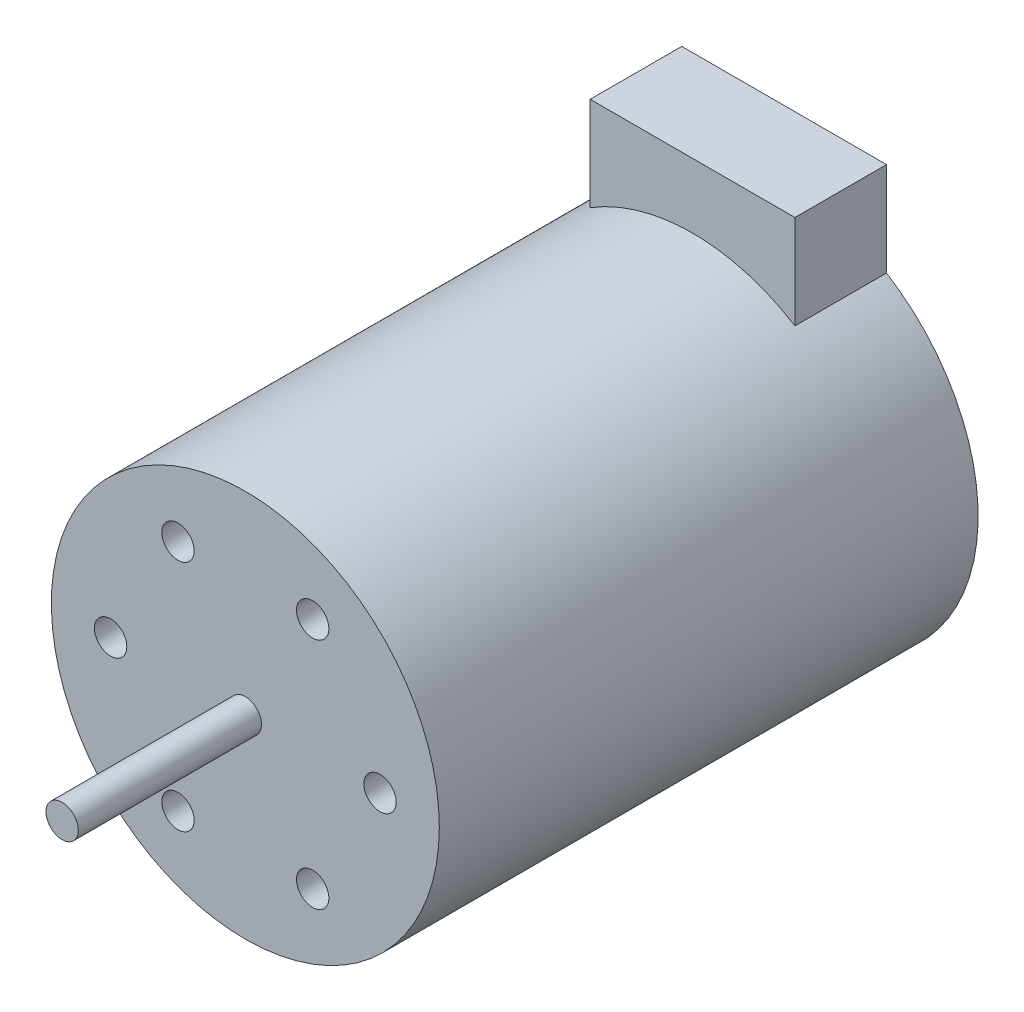
from build123d import *

# Parameters (mm, degrees)
SKETCH1_R           = 18
BOSS_EXTRUDE1_DEPTH = 50
SKETCH2_R           = 1.5
BOSS_EXTRUDE2_DEPTH = 17
SKETCH3_W           = 19
SKETCH3_H           = 8.5
BOSS_EXTRUDE3_DEPTH = 24
SKETCH4_R           = 1.5
CUT_EXTRUDE1_DEPTH  = 5


with BuildPart() as part:
    # Sketch1 → Boss-Extrude1 (new body)
    with BuildSketch(Plane.XY):
        Circle(SKETCH1_R)
    extrude(amount=BOSS_EXTRUDE1_DEPTH)

    # Sketch2 → Boss-Extrude2 (add)
    with BuildSketch(Plane.XY.offset(50)):
        Circle(SKETCH2_R)
    extrude(amount=BOSS_EXTRUDE2_DEPTH)

    # Sketch3 → Boss-Extrude3 (add)
    with BuildSketch(Plane(origin=(0, 0, 0), x_dir=(1, 0, 0), z_dir=(0, 1, 0))):
        with Locations((0, -4.25)):
            Rectangle(SKETCH3_W, SKETCH3_H)
    extrude(amount=BOSS_EXTRUDE3_DEPTH)

    # Sketch4 → Cut-Extrude1 (cut)
    with BuildSketch(Plane.XY.offset(50)):
        with Locations((12.5, 0)):
            Circle(SKETCH4_R)
        with Locations((6.25, -10.825317547)):
            Circle(SKETCH4_R)
        with Locations((-6.25, -10.825317547)):
            Circle(SKETCH4_R)
        with Locations((-12.5, 0)):
            Circle(SKETCH4_R)
        with Locations((-6.25, 10.825317547)):
            Circle(SKETCH4_R)
        with Locations((6.25, 10.825317547)):
            Circle(SKETCH4_R)
    extrude(amount=-CUT_EXTRUDE1_DEPTH, mode=Mode.SUBTRACT)


solid = part.part
